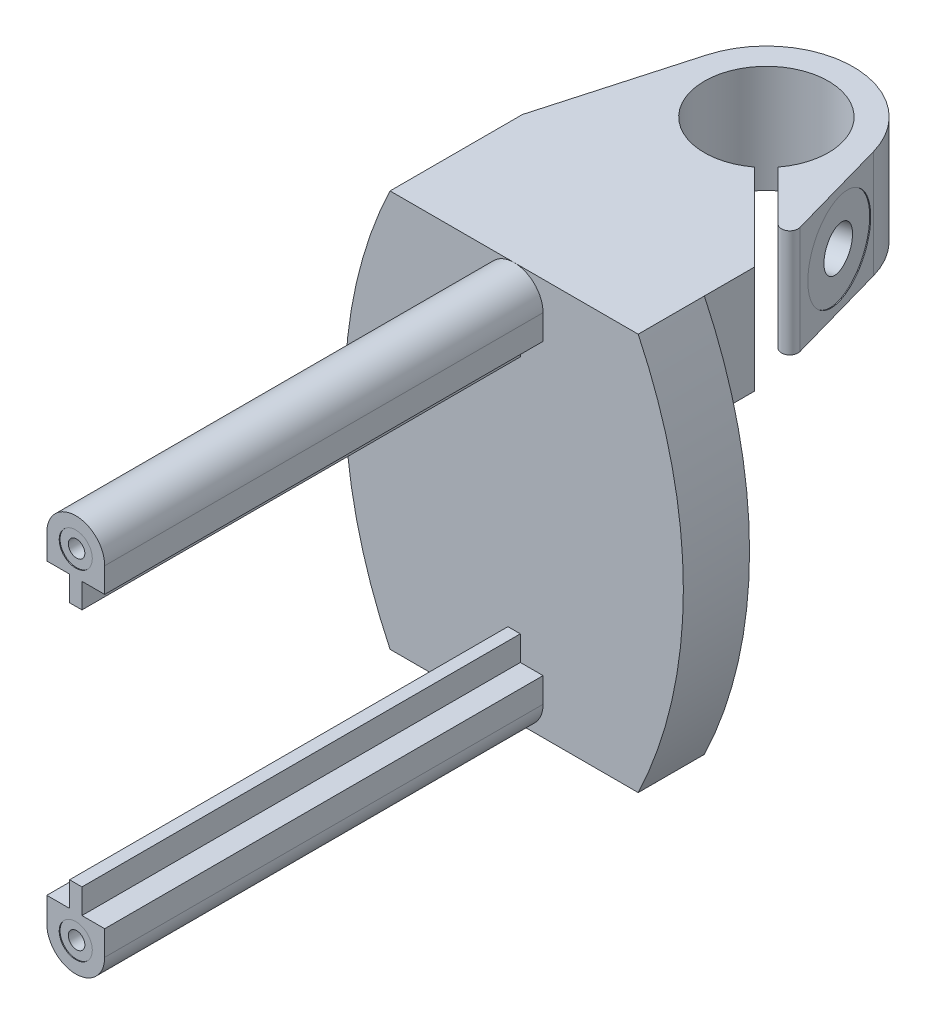
from build123d import *

# Parameters (mm, degrees)
SKETCH1_R               = 7.5
BOSS_EXTRUDE1_DEPTH     = 13
BOSS_EXTRUDE2_DEPTH     = 13
BOSS_EXTRUDE3_DEPTH     = 35
BOSS_EXTRUDE4_DEPTH     = 8
CUT_EXTRUDE3_DEPTH      = 6
CUT_EXTRUDE3_DEPTH_BACK = 6
BOSS_EXTRUDE5_DEPTH     = 53
SKETCH11_R              = 2
CUT_EXTRUDE4_DEPTH      = 0.1
SKETCH12_R              = 1
CUT_EXTRUDE5_DEPTH      = 52
SKETCH16_R              = 5.5
CUT_EXTRUDE8_DEPTH      = 0.1
SKETCH17_R              = 2.5
CUT_EXTRUDE9_DEPTH      = 20.1
CUT_EXTRUDE10_DEPTH     = 11
CUT_EXTRUDE11_DEPTH     = 25
CUT_EXTRUDE12_DEPTH     = 10
FILLET1_R               = 1


with BuildPart() as part:
    # Sketch1 → Boss-Extrude1 (new body)
    with BuildSketch(Plane(origin=(0, 0, 0), x_dir=(1, 0, 0), z_dir=(0, 1, 0))):
        with BuildLine():
            Line((-15.000119656, -22.499966246), (15.000119656, -22.499966246))
            Line((15.000119656, -22.499966246), (15.000119656, -14.499966246))
            Line((15.000119656, -14.499966246), (10.105611377, 2.850722488))
            ThreePointArc((10.105611377, 2.850722488), (0, 10.5), (-10.105611377, 2.850722488))
            Line((-10.105611377, 2.850722488), (-15.000119656, -14.499966246))
            Line((-15.000119656, -14.499966246), (-15.000119656, -22.499966246))
        make_face()
        with Locations(Location((0, 0, 0), (0, 0, 90))):
            Circle(SKETCH1_R, mode=Mode.SUBTRACT)
    extrude(amount=BOSS_EXTRUDE1_DEPTH)

    # Sketch2 → Boss-Extrude2 (add)
    with BuildSketch(Plane(origin=(0, 0, 0), x_dir=(1, 0, 0), z_dir=(0, 1, 0))):
        Polygon((-15.000119656, -22.499966246), (-15.000119656, -30.499966246), (14.999880344, -30.499966246), (15.000119656, -22.499966246), align=None)
    extrude(amount=BOSS_EXTRUDE2_DEPTH)

    # Sketch3 → Boss-Extrude3 (add)
    with BuildSketch(Plane.XZ):
        Polygon((-15.000119656, 30.499966246), (14.999880344, 30.499966246), (15.000119656, 22.499966246), (-15.000119656, 22.499966246), align=None)
    extrude(amount=BOSS_EXTRUDE3_DEPTH)

    # Sketch4 → Boss-Extrude4 (add)
    with BuildSketch(Plane.XY.offset(30.499966246)):
        with BuildLine():
            Line((14.999880344, -35), (14.999880344, 13))
            ThreePointArc((14.999880344, 13), (20.461578839, -11), (14.999880344, -35))
        make_face()
        with BuildLine():
            Line((-15.000119656, -35), (-15.000119656, 13))
            ThreePointArc((-15.000119656, 13), (-20.461818151, -11), (-15.000119656, -35))
        make_face()
    extrude(amount=-BOSS_EXTRUDE4_DEPTH)

    # Sketch9 → Cut-Extrude3 (cut, two sides: drawn at the far end of the back side and taken through both)
    with BuildSketch(Plane.XY.offset(22.5).offset(-CUT_EXTRUDE3_DEPTH_BACK)):
        with BuildLine():
            Line((-13.33053559, -32), (11.997996308, -32))
            Line((11.997996308, -32), (13.330296278, -32))
            ThreePointArc((13.330296278, -32), (17.049056164, -17.737940448), (16.879854834, -3))
            Line((16.879854834, -3), (15, -3))
            Line((15, -3), (-16.880094146, -3))
            ThreePointArc((-16.880094146, -3), (-17.049295477, -17.737940448), (-13.33053559, -32))
        make_face()
    extrude(amount=CUT_EXTRUDE3_DEPTH + CUT_EXTRUDE3_DEPTH_BACK, mode=Mode.SUBTRACT)

    # Sketch10 → Boss-Extrude5 (add)
    with BuildSketch(Plane.XY.offset(30.499966246)):
        with BuildLine():
            Line((-3.500119656, -28.5), (-0.750119656, -28.5))
            Line((-0.750119656, -28.5), (-0.750119656, -25.5))
            Line((-0.750119656, -25.5), (-0.000119656, -25.5))
            Line((-0.000119656, -25.5), (0.749880344, -25.5))
            Line((0.749880344, -25.5), (0.749880344, -28.5))
            Line((0.749880344, -28.5), (3.499880344, -28.5))
            Line((3.499880344, -28.5), (3.499880344, -31.5))
            ThreePointArc((3.499880344, -31.5), (-0.000119656, -35), (-3.500119656, -31.5))
            Line((-3.500119656, -31.5), (-3.500119656, -28.5))
        make_face()
        with BuildLine():
            Line((0.749880344, 6.5), (3.499880344, 6.5))
            Line((3.499880344, 6.5), (3.499880344, 9.5))
            ThreePointArc((3.499880344, 9.5), (-0.000119656, 13), (-3.500119656, 9.5))
            Line((-3.500119656, 9.5), (-3.500119656, 6.5))
            Line((-3.500119656, 6.5), (-0.750119656, 6.5))
            Line((-0.750119656, 6.5), (-0.750119656, 3.5))
            Line((-0.750119656, 3.5), (-0.000119656, 3.5))
            Line((-0.000119656, 3.5), (0.749880344, 3.5))
            Line((0.749880344, 3.5), (0.749880344, 6.5))
        make_face()
    extrude(amount=BOSS_EXTRUDE5_DEPTH)

    # Sketch11 → Cut-Extrude4 (cut)
    with BuildSketch(Plane.XY.offset(83.499966246)):
        with Locations((-0.000119656, -31.5)):
            Circle(SKETCH11_R)
        with Locations((-0.000119656, 9.5)):
            Circle(SKETCH11_R)
    extrude(amount=-CUT_EXTRUDE4_DEPTH, mode=Mode.SUBTRACT)

    # Sketch12 → Cut-Extrude5 (cut)
    with BuildSketch(Plane.XY.offset(83.399966246)):
        with Locations((-0.000119656, -31.5)):
            Circle(SKETCH12_R)
        with Locations((-0.000119656, 9.5)):
            Circle(SKETCH12_R)
    extrude(amount=-CUT_EXTRUDE5_DEPTH, mode=Mode.SUBTRACT)

    # Sketch16 → Cut-Extrude8 (cut)
    with BuildSketch(Plane(origin=(10.105611377, 0, -2.850722488), x_dir=(-0.27149737978458055, 0, -0.9624391787381202), z_dir=(0.9624391787381201, 0, -0.2714973797845805))):
        with Locations((-6, 6.5)):
            Circle(SKETCH16_R)
    extrude(amount=-CUT_EXTRUDE8_DEPTH, mode=Mode.SUBTRACT)

    # Sketch17 → Cut-Extrude9 (cut)
    with BuildSketch(Plane(origin=(10.009367459, 0, -2.82357275), x_dir=(-0.2714973797845806, 0, -0.9624391787381202), z_dir=(0.9624391787381201, 0, -0.27149737978458055))):
        with Locations((-6, 6.5)):
            Circle(SKETCH17_R)
    extrude(amount=-CUT_EXTRUDE9_DEPTH, mode=Mode.SUBTRACT)

    # Sketch18 → Cut-Extrude10 (cut)
    with BuildSketch(Plane.XZ):
        with BuildLine():
            Line((-8.45474492, 13.294804883), (-8.86199099, 11.851146114))
            ThreePointArc((-8.86199099, 11.851146114), (-12.563800666, 9.778320718), (-10.490975269, 6.076511042))
            Line((-10.490975269, 6.076511042), (-10.898221339, 4.632852274))
            Line((-10.898221339, 4.632852274), (-7.048464624, 3.546862755))
            Line((-7.048464624, 3.546862755), (-4.604988206, 12.208815363))
            Line((-4.604988206, 12.208815363), (-8.45474492, 13.294804883))
        make_face()
    extrude(amount=-CUT_EXTRUDE10_DEPTH, mode=Mode.SUBTRACT)

    # Sketch19 → Cut-Extrude11 (cut)
    with BuildSketch(Plane.XZ):
        Polygon((16.189167047, 14.774953484), (16.896273828, 15.482060265), (15.482060265, 16.896273828), (14.774953484, 16.189167047), (14.067846703, 15.482060265), (3.042893219, 4.457106781), (4.457106781, 3.042893219), (15.482060265, 14.067846703), align=None)
    extrude(amount=-CUT_EXTRUDE11_DEPTH, mode=Mode.SUBTRACT)

    # Sketch20 → Cut-Extrude12 (cut)
    with BuildSketch(Plane.XZ):
        Polygon((-12.998307469, 20.504333218), (-12.998307469, 19.504333218), (4.548842229, 8.791482916), (12.171692531, 16.414333218), (12.171692531, 20.504333218), align=None)
    extrude(amount=-CUT_EXTRUDE12_DEPTH, mode=Mode.SUBTRACT)

    # Fillet1
    fillet1_edges = [part.edges().sort_by_distance(p)[0] for p in [
        (14.640950567, 6.5, 13.226737005),
        (12.171692531, 5, 16.414333218),
        (4.548842229, 5, 8.791482916),
        (-13.33053559, -32, 25.499983123),
        (-17.049295477, -17.737940448, 28.5),
        (-16.880094146, -3, 25.499983123),
        (-0.000119656, -3, 28.5),
        (16.879854834, -3, 25.499983123),
        (13.330296278, -32, 25.499983123),
        (-0.000119656, -32, 28.5),
        (17.049056164, -17.737940448, 28.5),
    ]]
    fillet(fillet1_edges, radius=FILLET1_R)


solid = part.part
